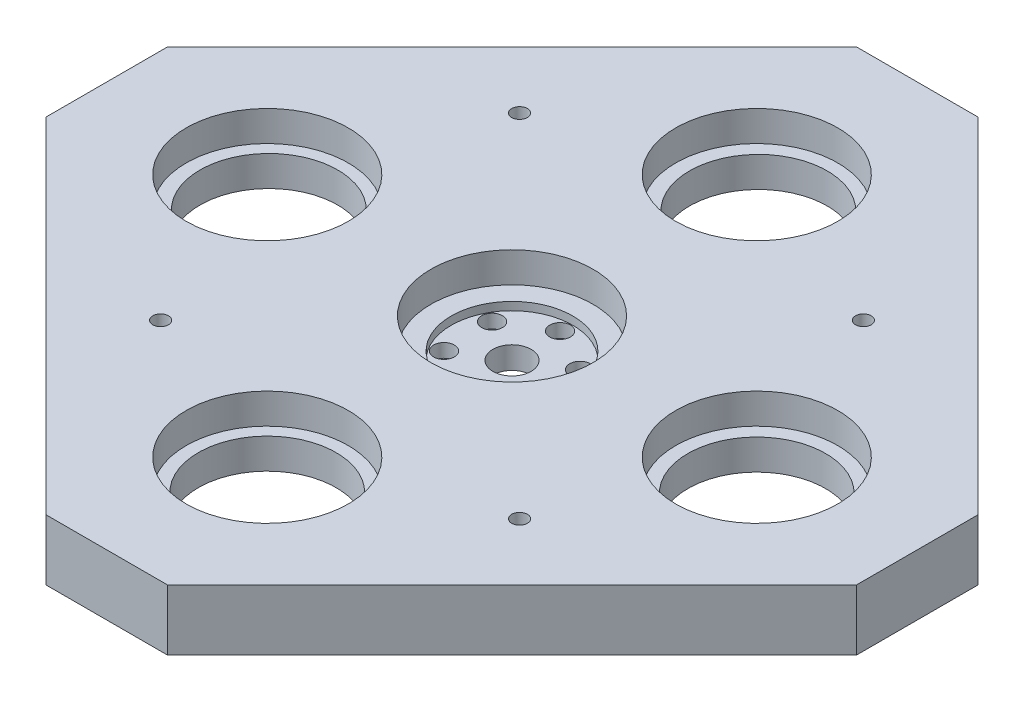
from build123d import *

# Parameters (mm, degrees)
SKETCH1_W                                         = 254
SKETCH1_H                                         = 254
BOSS_EXTRUDE1_DEPTH                               = 19.05
SKETCH2_R                                         = 25.4
CUT_EXTRUDE1_DEPTH                                = 9.525
SKETCH3_R                                         = 5.999999938
CUT_EXTRUDE2_DEPTH                                = 360.336507504
CBORE_FOR_M3_SHCS1_AT_2_COUNT                     = 2
CBORE_FOR_M3_SHCS1_AT_2_PITCH                     = 15.5
CBORE_FOR_M3_SHCS1_AT_3_COUNT                     = 2
CBORE_FOR_M3_SHCS1_AT_3_PITCH                     = 26.846787517
CBORE_FOR_M3_SHCS1_AT_4_COUNT                     = 2
CBORE_FOR_M3_SHCS1_AT_4_PITCH                     = 31
CBORE_FOR_M3_SHCS1_AT_5_COUNT                     = 2
CBORE_FOR_M3_SHCS1_AT_5_PITCH                     = 26.846787517
CBORE_FOR_M3_SHCS1_AT_6_COUNT                     = 2
CBORE_FOR_M3_SHCS1_AT_6_PITCH                     = 15.5
SKETCH6_R                                         = 19.05
CUT_EXTRUDE3_DEPTH                                = 2.54
SKETCH7_R                                         = 19.05
CUT_EXTRUDE4_DEPTH                                = 2.54
FILLET1_SIZE                                      = 107.95
CSK_FOR_8_FLAT_HEAD_MACHINE_SCREW_100_D           = 4.9149
CSK_FOR_8_FLAT_HEAD_MACHINE_SCREW_100_CSINK_D     = 8.4328
CSK_FOR_8_FLAT_HEAD_MACHINE_SCREW_100_CSINK_ANGLE = 100
CUT_EXTRUDE6_DEPTH                                = 360.412804759
CUT_EXTRUDE6_DEPTH_BACK                           = 360.412804759
SKETCH14_R                                        = 21.59


with BuildPart() as part:
    # Sketch1 → Boss-Extrude1 (new body)
    with BuildSketch(Plane(origin=(0, 0, 0), x_dir=(1, 0, 0), z_dir=(0, 1, 0))):
        with Locations((127, 127)):
            Rectangle(SKETCH1_W, SKETCH1_H)
    extrude(amount=BOSS_EXTRUDE1_DEPTH)

    # Sketch2 → Cut-Extrude1 (cut)
    with BuildSketch(Plane(origin=(0, 19.05, 0), x_dir=(1, 0, 0), z_dir=(0, 1, 0))):
        with Locations(Location((50.292, 127, 0), (0, 0, 270))):
            Circle(SKETCH2_R)
        with Locations(Location((127, 50.292, 0), (0, 0, 270))):
            Circle(SKETCH2_R)
        with Locations(Location((127, 127, 0), (0, 0, 270))):
            Circle(SKETCH2_R)
        with Locations(Location((203.708, 127, 0), (0, 0, 270))):
            Circle(SKETCH2_R)
        with Locations(Location((127, 203.708, 0), (0, 0, 270))):
            Circle(SKETCH2_R)
    extrude(amount=-CUT_EXTRUDE1_DEPTH, mode=Mode.SUBTRACT)

    # Sketch3 → Cut-Extrude2 (cut, through all)
    with BuildSketch(Plane(origin=(0, 9.525, 0), x_dir=(1, 0, 0), z_dir=(0, 1, 0))):
        with Locations(Location((127, 127, 0), (0, 0, 270))):
            Circle(SKETCH3_R)
    extrude(amount=-CUT_EXTRUDE2_DEPTH, mode=Mode.SUBTRACT)

    # Sketch5 → CBORE for M3 SHCS1 (revolve, cut)
    with BuildSketch(Plane(origin=(127.424882459, 9.525, -111.505824485), x_dir=(0, 0, 1), z_dir=(1, 0, 0))):
        Polygon((0, 0), (0, 11.689463052), (1.7, 10.668), (1.7, 6.81), (3.25, 6.81), (3.25, 0.025), (3.275, 0), align=None)
    cbore_for_m3_shcs1 = revolve(axis=Axis((127.424882459, 15.875, -111.505824485), (0, -1, 0)), mode=Mode.SUBTRACT)

    # CBORE for M3 SHCS1 at 2: CBORE for M3 SHCS1 ×2
    with Locations(*[Vector(-0.8794058604138406, 0, -0.47607282286410013) * (i * CBORE_FOR_M3_SHCS1_AT_2_PITCH) for i in range(1, CBORE_FOR_M3_SHCS1_AT_2_COUNT)]):
        add(cbore_for_m3_shcs1, mode=Mode.SUBTRACT)

    # CBORE for M3 SHCS1 at 3: CBORE for M3 SHCS1 ×2
    with Locations(*[Vector(-0.5235514039232533, 0, -0.8519940888585968) * (i * CBORE_FOR_M3_SHCS1_AT_3_PITCH) for i in range(1, CBORE_FOR_M3_SHCS1_AT_3_COUNT)]):
        add(cbore_for_m3_shcs1, mode=Mode.SUBTRACT)

    # CBORE for M3 SHCS1 at 4: CBORE for M3 SHCS1 ×2
    with Locations(*[Vector(-0.027411771555246985, 0, -0.9996242267873479) * (i * CBORE_FOR_M3_SHCS1_AT_4_PITCH) for i in range(1, CBORE_FOR_M3_SHCS1_AT_4_COUNT)]):
        add(cbore_for_m3_shcs1, mode=Mode.SUBTRACT)

    # CBORE for M3 SHCS1 at 5: CBORE for M3 SHCS1 ×2
    with Locations(*[Vector(0.47607282286409475, 0, -0.8794058604138435) * (i * CBORE_FOR_M3_SHCS1_AT_5_PITCH) for i in range(1, CBORE_FOR_M3_SHCS1_AT_5_COUNT)]):
        add(cbore_for_m3_shcs1, mode=Mode.SUBTRACT)

    # CBORE for M3 SHCS1 at 6: CBORE for M3 SHCS1 ×2
    with Locations(*[Vector(0.8519940888585981, 0, -0.5235514039232514) * (i * CBORE_FOR_M3_SHCS1_AT_6_PITCH) for i in range(1, CBORE_FOR_M3_SHCS1_AT_6_COUNT)]):
        add(cbore_for_m3_shcs1, mode=Mode.SUBTRACT)

    # Sketch6 → Cut-Extrude3 (cut)
    with BuildSketch(Plane(origin=(0, 9.525, 0), x_dir=(1, 0, 0), z_dir=(0, 1, 0))):
        with Locations(Location((127, 50.292, 0), (0, 0, 270))):
            Circle(SKETCH6_R)
        with Locations(Location((50.546, 127.254, 0), (0, 0, 270))):
            Circle(SKETCH6_R)
        with Locations(Location((127.508, 203.708, 0), (0, 0, 270))):
            Circle(SKETCH6_R)
        with Locations(Location((203.962, 126.746, 0), (0, 0, 270))):
            Circle(SKETCH6_R)
    extrude(amount=-CUT_EXTRUDE3_DEPTH, mode=Mode.SUBTRACT)

    # Sketch7 → Cut-Extrude4 (cut)
    with BuildSketch(Plane(origin=(0, 9.525, 0), x_dir=(1, 0, 0), z_dir=(0, 1, 0))):
        with Locations(Location((127, 127, 0), (0, 0, 270))):
            Circle(SKETCH7_R)
    extrude(amount=-CUT_EXTRUDE4_DEPTH, mode=Mode.SUBTRACT)

    # Fillet1
    fillet1_edges = [part.edges().sort_by_distance(p)[0] for p in [
        (0, 9.525, -254),
        (254, 9.525, -254),
        (254, 9.525, 0),
        (0, 9.525, 0),
    ]]
    chamfer(fillet1_edges, length=FILLET1_SIZE)

    # CSK for #8 Flat Head Machine Screw (100)2 (through all)
    with Locations(Plane(origin=(0, 0, 0), x_dir=(-1, 0, 0), z_dir=(0, -1, 0))):
        with Locations((-183.247438789, 73.118463274), (-73.118463274, 70.752561211), (-183.247438789, 180.881536726), (-73.118463274, 183.247438789)):
            CounterSinkHole(CSK_FOR_8_FLAT_HEAD_MACHINE_SCREW_100_D / 2, CSK_FOR_8_FLAT_HEAD_MACHINE_SCREW_100_CSINK_D / 2, counter_sink_angle=CSK_FOR_8_FLAT_HEAD_MACHINE_SCREW_100_CSINK_ANGLE)

    # Sketch14 → Cut-Extrude6 (cut, two sides: drawn at the far end of the back side and taken through both)
    with BuildSketch(Plane(origin=(0, 6.985, 0), x_dir=(1, 0, 0), z_dir=(0, 1, 0)).offset(-CUT_EXTRUDE6_DEPTH_BACK)):
        with Locations(Location((127, 50.292, 0), (0, 0, 270))):
            Circle(SKETCH14_R)
        with Locations(Location((203.962, 126.746, 0), (0, 0, 270))):
            Circle(SKETCH14_R)
        with Locations(Location((127.508, 203.708, 0), (0, 0, 270))):
            Circle(SKETCH14_R)
        with Locations(Location((50.546, 127.254, 0), (0, 0, 270))):
            Circle(SKETCH14_R)
    extrude(amount=CUT_EXTRUDE6_DEPTH + CUT_EXTRUDE6_DEPTH_BACK, mode=Mode.SUBTRACT)


solid = part.part
